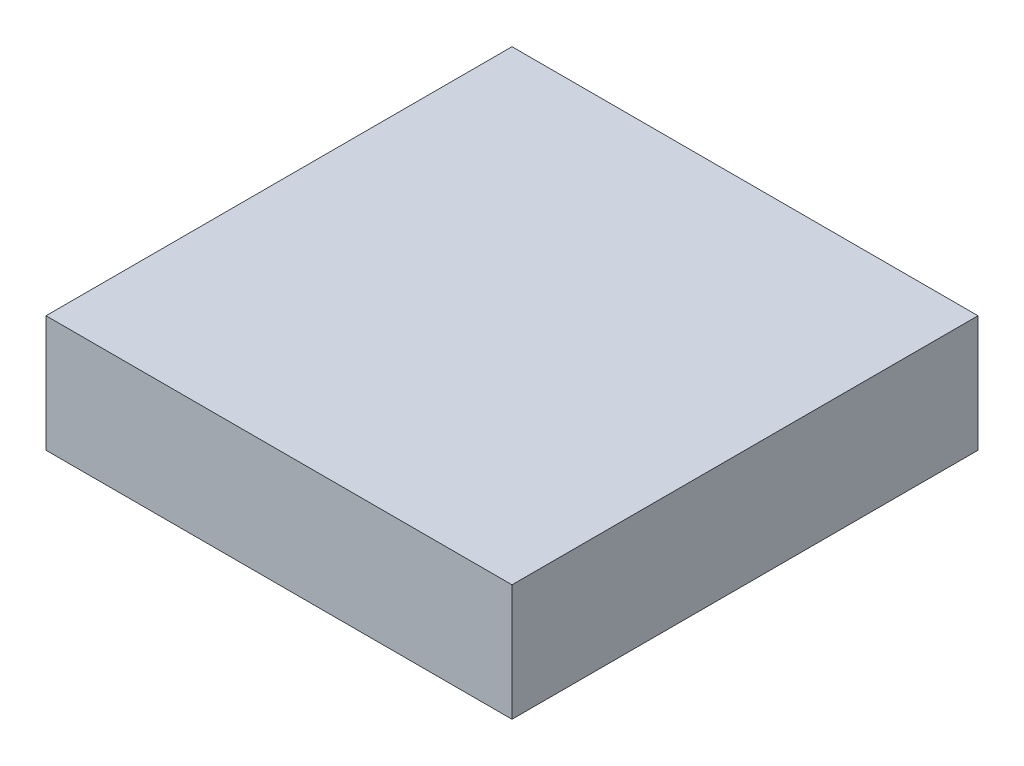
from build123d import *

# Parameters (mm, degrees)
SKETCH2_W           = 203.2
SKETCH2_H           = 203.2
BOSS_EXTRUDE1_DEPTH = 50.8


with BuildPart() as part:
    # Sketch2 → Boss-Extrude1 (new body)
    with BuildSketch(Plane(origin=(0, 0, 0), x_dir=(1, 0, 0), z_dir=(0, 1, 0))):
        Rectangle(SKETCH2_W, SKETCH2_H)
    extrude(amount=BOSS_EXTRUDE1_DEPTH)


solid = part.part
